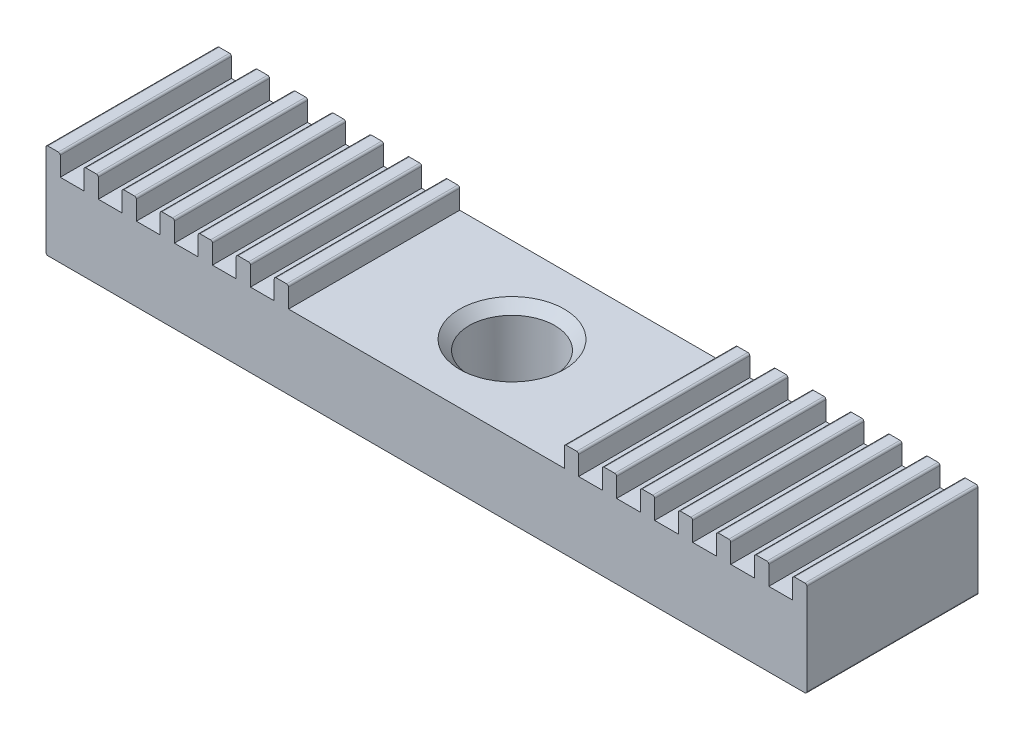
from build123d import *

# Parameters (mm, degrees)
SKETCH1_W           = 40
SKETCH1_H           = 3.9
BOSS_EXTRUDE1_DEPTH = 9
CUT_EXTRUDE1_REACH  = 24.276
SKETCH2_R           = 2.25
SKETCH3_W           = 0.75
SKETCH3_H           = 1.1
BOSS_EXTRUDE2_DEPTH = 9
FILLET1_R           = 0.1
CHAMFER1_SIZE       = 0.5


with BuildPart() as part:
    # Sketch1 → Boss-Extrude1 (new body)
    with BuildSketch(Plane.XY):
        with Locations((0, -1.95)):
            Rectangle(SKETCH1_W, SKETCH1_H)
    extrude(amount=BOSS_EXTRUDE1_DEPTH)

    # Sketch2 → Cut-Extrude1 (cut, up to next)
    with BuildSketch(Plane(origin=(0, 0, 0), x_dir=(1, 0, 0), z_dir=(0, 1, 0)), mode=Mode.PRIVATE) as cut_extrude1_sk1:
        with Locations(Location((0, -4.5, 0), (0, 0, 270))):
            Circle(SKETCH2_R)
    cut_extrude1_tool1 = extrude(cut_extrude1_sk1.sketch, amount=-CUT_EXTRUDE1_REACH, mode=Mode.PRIVATE) & part.part
    add(cut_extrude1_tool1.solids().sort_by_distance((0, 0, 4.5))[0], mode=Mode.SUBTRACT)

    # Sketch3 → Boss-Extrude2 (add)
    with BuildSketch(Plane.XY.offset(9)):
        with Locations((-17.625, 0.55)):
            Rectangle(SKETCH3_W, SKETCH3_H)
        with Locations((-19.625, 0.55)):
            Rectangle(SKETCH3_W, SKETCH3_H)
        with Locations((-15.625, 0.55)):
            Rectangle(SKETCH3_W, SKETCH3_H)
        with Locations((-13.625, 0.55)):
            Rectangle(SKETCH3_W, SKETCH3_H)
        with Locations((-11.625, 0.55)):
            Rectangle(SKETCH3_W, SKETCH3_H)
        with Locations((-9.625, 0.55)):
            Rectangle(SKETCH3_W, SKETCH3_H)
        with Locations((-7.625, 0.55)):
            Rectangle(SKETCH3_W, SKETCH3_H)
        with Locations((7.625, 0.55)):
            Rectangle(SKETCH3_W, SKETCH3_H)
        with Locations((9.625, 0.55)):
            Rectangle(SKETCH3_W, SKETCH3_H)
        with Locations((11.625, 0.55)):
            Rectangle(SKETCH3_W, SKETCH3_H)
        with Locations((13.625, 0.55)):
            Rectangle(SKETCH3_W, SKETCH3_H)
        with Locations((15.625, 0.55)):
            Rectangle(SKETCH3_W, SKETCH3_H)
        with Locations((17.625, 0.55)):
            Rectangle(SKETCH3_W, SKETCH3_H)
        with Locations((19.625, 0.55)):
            Rectangle(SKETCH3_W, SKETCH3_H)
    extrude(amount=-BOSS_EXTRUDE2_DEPTH)

    # Fillet1
    fillet1_edges = [part.edges().sort_by_distance(p)[0] for p in [
        (9.25, 1.1, 4.5),
        (10, 1.1, 4.5),
        (11.25, 1.1, 4.5),
        (12, 1.1, 4.5),
        (13.25, 1.1, 4.5),
        (14, 1.1, 4.5),
        (15.25, 1.1, 4.5),
        (16, 1.1, 4.5),
        (17.25, 1.1, 4.5),
        (18, 1.1, 4.5),
        (19.25, 1.1, 4.5),
        (20, 1.1, 4.5),
        (-20, 1.1, 4.5),
        (-19.25, 1.1, 4.5),
        (-18, 1.1, 4.5),
        (-17.25, 1.1, 4.5),
        (-16, 1.1, 4.5),
        (-15.25, 1.1, 4.5),
        (-14, 1.1, 4.5),
        (-13.25, 1.1, 4.5),
        (-12, 1.1, 4.5),
        (-11.25, 1.1, 4.5),
        (-10, 1.1, 4.5),
        (-9.25, 1.1, 4.5),
        (20, -3.9, 4.5),
        (-20, -3.9, 4.5),
        (-8, 1.1, 4.5),
        (-7.25, 1.1, 4.5),
        (7.25, 1.1, 4.5),
        (8, 1.1, 4.5),
    ]]
    fillet(fillet1_edges, radius=FILLET1_R)

    # Chamfer1
    chamfer1_edges = [part.edges().sort_by_distance(p)[0] for p in [
        (0, 0, 2.25),
    ]]
    chamfer(chamfer1_edges, length=CHAMFER1_SIZE)


solid = part.part
